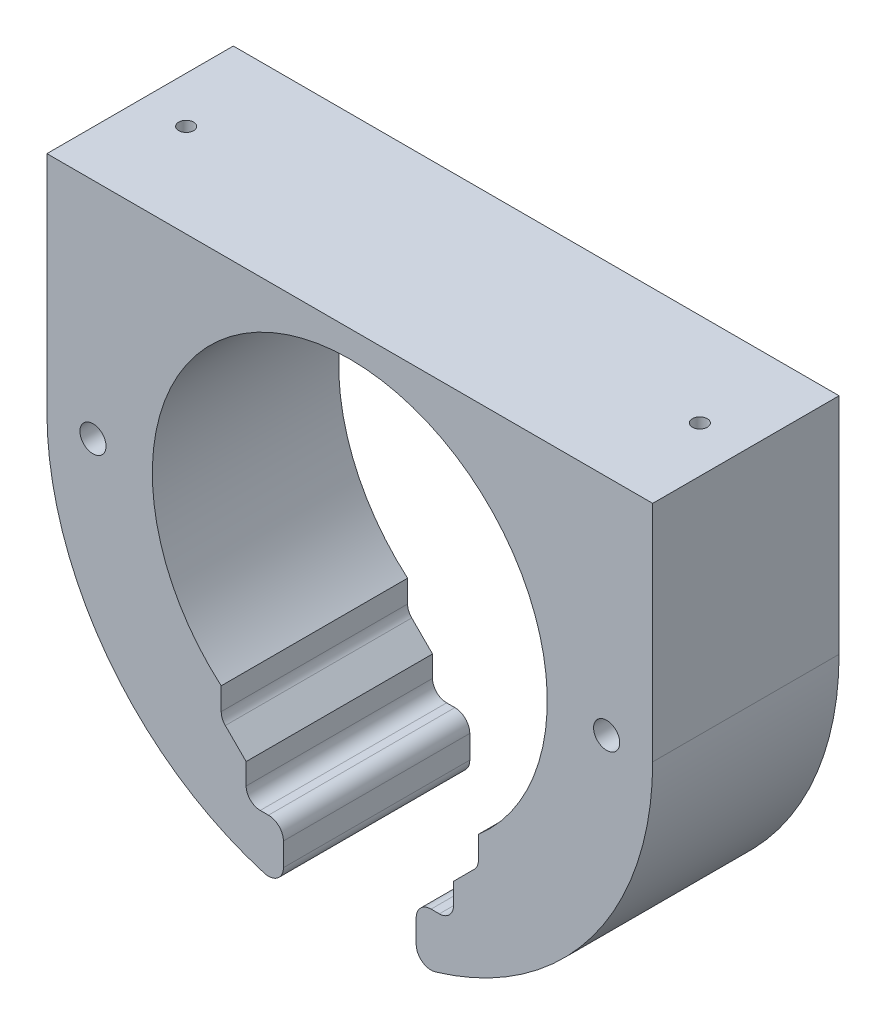
from build123d import *

# Parameters (mm, degrees)
SKETCH1_R           = 0.889
BOSS_EXTRUDE1_DEPTH = 12.7
SKETCH2_R           = 0.508
CUT_EXTRUDE1_DEPTH  = 12.7


with BuildPart() as part:
    # Sketch1 → Boss-Extrude1 (new body)
    with BuildSketch(Plane.XY):
        with BuildLine():
            Line((-20.6375, -7.688584311), (-20.6375, 7.567266813))
            Line((-20.6375, 7.567266813), (20.6375, 7.567266813))
            Line((20.6375, 7.567266813), (20.6375, -7.688584311))
            ThreePointArc((20.6375, -7.688584311), (16.525068691, -20.050967212), (5.826741818, -27.486450005))
            ThreePointArc((5.826741818, -27.486450005), (4.931277216, -27.325327691), (4.523886836, -26.511785848))
            Line((4.523886836, -26.511785848), (4.523886836, -24.938668143))
            ThreePointArc((4.523886836, -24.938668143), (4.821466346, -24.220247653), (5.539886836, -23.922668143))
            Line((5.539886836, -23.922668143), (6.102813797, -23.922668143))
            ThreePointArc((6.102813797, -23.922668143), (6.78239506, -23.641176367), (7.063886836, -22.961595104))
            Line((7.063886836, -22.961595104), (7.063886836, -21.519985546))
            Line((7.063886836, -21.519985546), (8.481348217, -20.102524164))
            ThreePointArc((8.481348217, -20.102524164), (8.689682664, -19.79072963), (8.762839993, -19.422942901))
            Line((8.762839993, -19.422942901), (8.762839993, -17.898886311))
            ThreePointArc((8.762839993, -17.898886311), (11.420440685, -14.802736841), (13.027769559, -11.052339947))
            ThreePointArc((13.027769559, -11.052339947), (13.455022544, -7.688584311), (13.027769559, -4.324828675))
            ThreePointArc((13.027769559, -4.324828675), (0, 5.766438233), (-13.027769559, -4.324828675))
            ThreePointArc((-13.027769559, -4.324828675), (-13.455022544, -7.688584311), (-13.027769559, -11.052339947))
            ThreePointArc((-13.027769559, -11.052339947), (-11.420440685, -14.802736841), (-8.762839993, -17.898886311))
            Line((-8.762839993, -17.898886311), (-8.762839993, -19.422942901))
            ThreePointArc((-8.762839993, -19.422942901), (-8.689682664, -19.79072963), (-8.481348217, -20.102524164))
            Line((-8.481348217, -20.102524164), (-7.063886836, -21.519985546))
            Line((-7.063886836, -21.519985546), (-7.063886836, -22.961595104))
            ThreePointArc((-7.063886836, -22.961595104), (-6.78239506, -23.641176367), (-6.102813797, -23.922668143))
            Line((-6.102813797, -23.922668143), (-5.539886836, -23.922668143))
            ThreePointArc((-5.539886836, -23.922668143), (-4.821466346, -24.220247653), (-4.523886836, -24.938668143))
            Line((-4.523886836, -24.938668143), (-4.523886836, -26.511785848))
            ThreePointArc((-4.523886836, -26.511785848), (-4.931277216, -27.325327691), (-5.826741818, -27.486450005))
            ThreePointArc((-5.826741818, -27.486450005), (-16.525068691, -20.050967212), (-20.6375, -7.688584311))
        make_face()
        with Locations((-17.5, -7.688584311)):
            Circle(SKETCH1_R, mode=Mode.SUBTRACT)
        with Locations((17.5, -7.688584311)):
            Circle(SKETCH1_R, mode=Mode.SUBTRACT)
    extrude(amount=BOSS_EXTRUDE1_DEPTH)

    # Sketch2 → Cut-Extrude1 (cut)
    with BuildSketch(Plane(origin=(0, 7.567266813, 0), x_dir=(1, 0, 0), z_dir=(0, 1, 0))):
        with Locations(Location((-17.5, -6.35, 0), (0, 0, 270))):
            Circle(SKETCH2_R)
        with Locations(Location((17.5, -6.35, 0), (0, 0, 270))):
            Circle(SKETCH2_R)
    extrude(amount=-CUT_EXTRUDE1_DEPTH, mode=Mode.SUBTRACT)


solid = part.part
